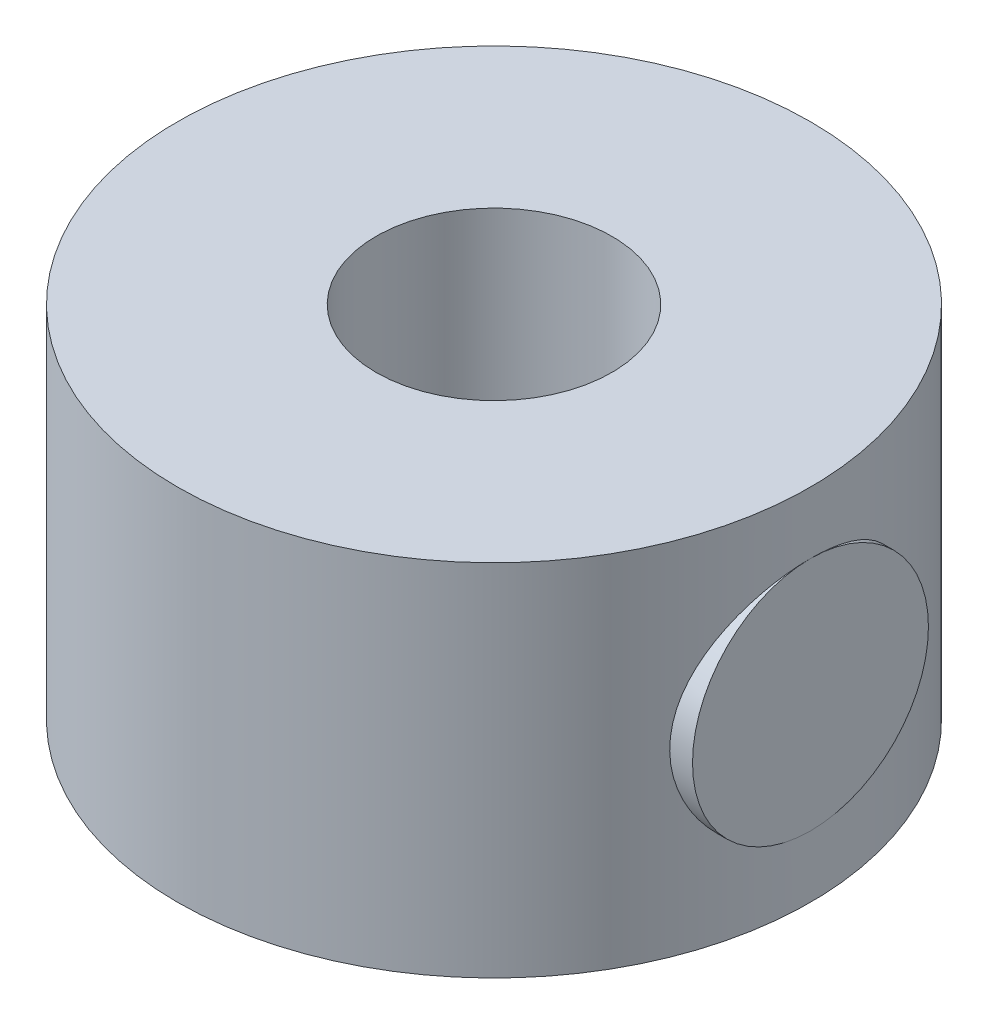
from build123d import *

# Parameters (mm, degrees)
SKETCH1_R           = 5.588
SKETCH1_R_2         = 2.0828
BOSS_EXTRUDE1_DEPTH = 6.35
BOSS_EXTRUDE2_REACH = 16.016
SKETCH3_R           = 2.0828


with BuildPart() as part:
    # Sketch1 → Boss-Extrude1 (new body)
    with BuildSketch(Plane(origin=(0, 0, 0), x_dir=(1, 0, 0), z_dir=(0, 1, 0))):
        with Locations(Location((0, 0, 0), (0, 0, 270))):
            Circle(SKETCH1_R)
        with Locations(Location((0, 0, 0), (0, 0, 270))):
            Circle(SKETCH1_R_2, mode=Mode.SUBTRACT)
    extrude(amount=BOSS_EXTRUDE1_DEPTH)

    # Sketch3 → Boss-Extrude2 (add, up to next)
    with BuildSketch(Plane(origin=(5.588, 0, 0), x_dir=(0, 0, -1), z_dir=(1, 0, 0)), mode=Mode.PRIVATE) as boss_extrude2_sk1:
        with Locations((0, 3.175)):
            Circle(SKETCH3_R)
    boss_extrude2_tool1 = extrude(boss_extrude2_sk1.sketch, amount=-BOSS_EXTRUDE2_REACH, mode=Mode.PRIVATE) - part.part
    add(boss_extrude2_tool1.solids().sort_by_distance((5.588, 3.175, 0))[0])
    add(boss_extrude2_tool1.solids().sort_by_distance((5.588, 3.175, 0))[1])


solid = part.part
